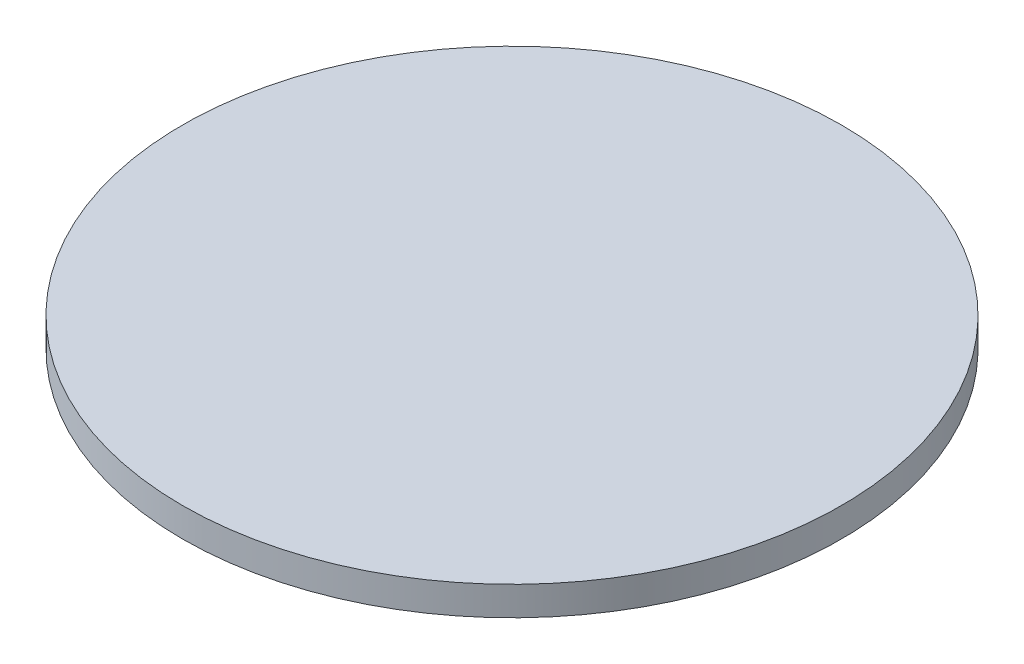
from build123d import *

# Parameters (mm, degrees)
SKETCH_1_R      = 12.5
EXTRUDE_1_DEPTH = 1.1


with BuildPart() as part:
    # 草图1 → 凸台-拉伸1 (new body)
    with BuildSketch(Plane(origin=(0, 0, 0), x_dir=(1, 0, 0), z_dir=(0, 1, 0))):
        with Locations(Location((12.5, 12.5, 0), (0, 0, 270))):
            Circle(SKETCH_1_R)
    extrude(amount=EXTRUDE_1_DEPTH)


solid = part.part
